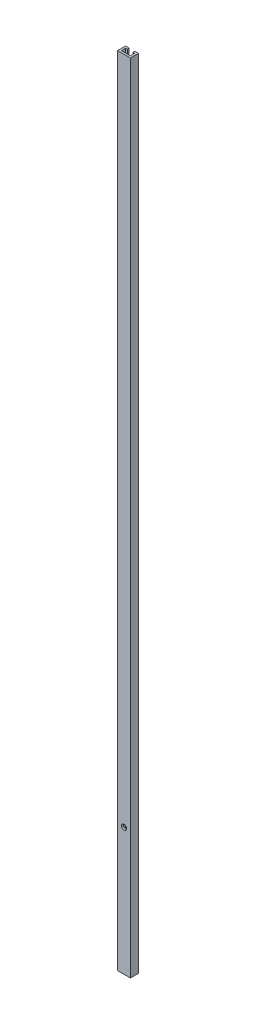
from build123d import *

# Parameters (mm, degrees)
EXTRUDE_1_DEPTH     = 500
SKETCH_2_R          = 1.6
CUT_EXTRUDE_1_DEPTH = 1.15


with BuildPart() as part:
    # 草图1 → 凸台-拉伸1 (new body)
    with BuildSketch(Plane(origin=(0, 0, 0), x_dir=(1, 0, 0), z_dir=(0, 1, 0))):
        Polygon((0, -5), (8, -5), (8, 0), (5.75, 0), (5.75, -1.15), (6.85, -1.15), (6.85, -3.85), (1.15, -3.85), (1.15, -1.15), (2.25, -1.15), (2.25, 0), (0, 0), align=None)
    extrude(amount=EXTRUDE_1_DEPTH)

    # 草图2 → 切除-拉伸1 (cut)
    with BuildSketch(Plane.XY.offset(5)):
        with Locations((4, 80)):
            Circle(SKETCH_2_R)
    extrude(amount=-CUT_EXTRUDE_1_DEPTH, mode=Mode.SUBTRACT)


solid = part.part
